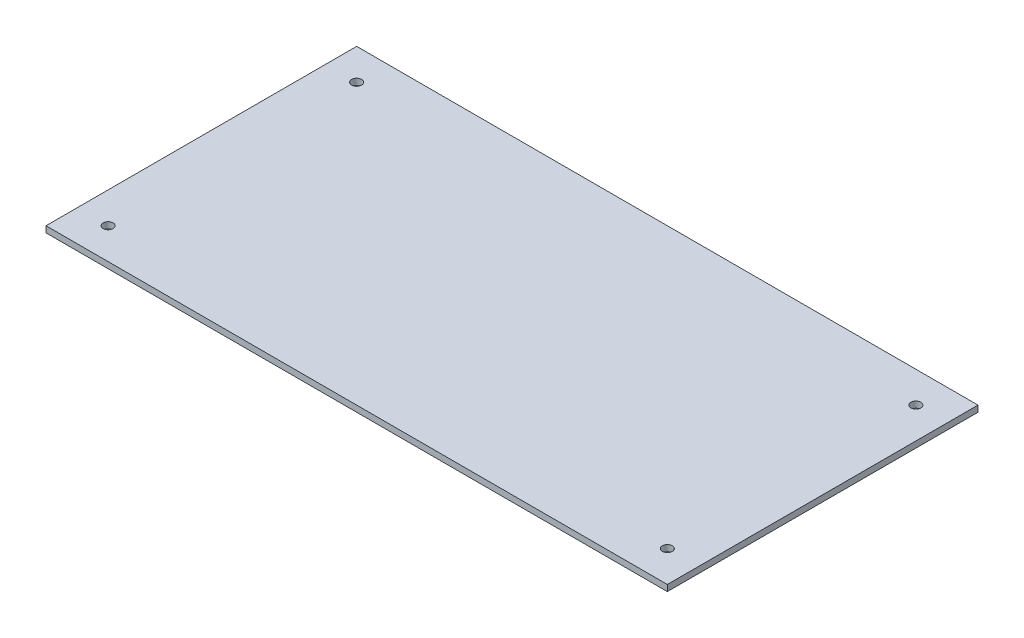
from build123d import *

# Parameters (mm, degrees)
SKETCH_1_W          = 200
SKETCH_1_H          = 100
EXTRUDE_1_DEPTH     = 2
SKETCH_2_R          = 1.6
CUT_EXTRUDE_1_DEPTH = 112.821285988


with BuildPart() as part:
    # 草图1 → 凸台-拉伸1 (new body)
    with BuildSketch(Plane(origin=(0, 0, 0), x_dir=(1, 0, 0), z_dir=(0, 1, 0))):
        Rectangle(SKETCH_1_W, SKETCH_1_H)
    extrude(amount=EXTRUDE_1_DEPTH)

    # 草图2 → 切除-拉伸1 (cut, through all)
    with BuildSketch(Plane(origin=(0, 2, 0), x_dir=(1, 0, 0), z_dir=(0, 1, 0))):
        with Locations(Location((-90, 40, 0), (0, 0, 270))):
            Circle(SKETCH_2_R)
        with Locations(Location((90, 40, 0), (0, 0, 90))):
            Circle(SKETCH_2_R)
        with Locations(Location((90, -40, 0), (0, 0, 270))):
            Circle(SKETCH_2_R)
        with Locations(Location((-90, -40, 0), (0, 0, 90))):
            Circle(SKETCH_2_R)
    extrude(amount=-CUT_EXTRUDE_1_DEPTH, mode=Mode.SUBTRACT)


solid = part.part
